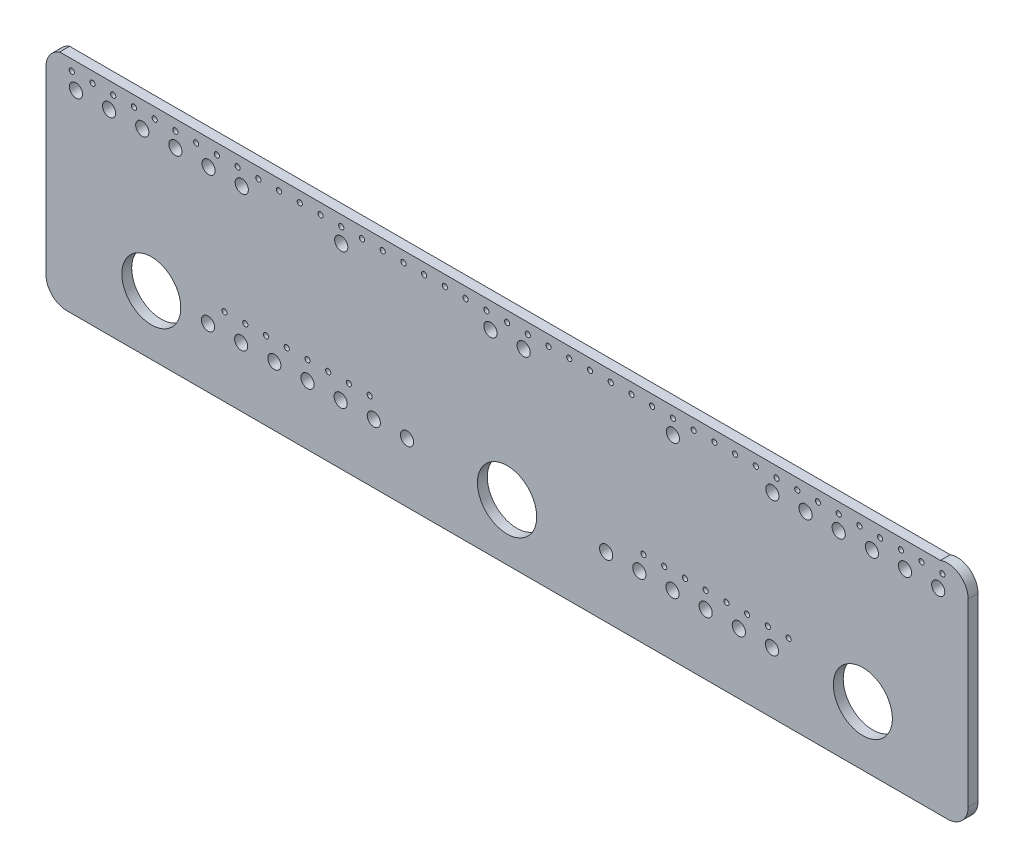
from build123d import *

# Parameters (mm, degrees)
SKETCH1_R           = 14.225
SKETCH1_R_2         = 14.3
SKETCH1_R_3         = 3.18
SKETCH1_R_4         = 1.25
BOSS_EXTRUDE5_DEPTH = 4.7625


with BuildPart() as part:
    # Sketch1 → Boss-Extrude5 (new body)
    with BuildSketch(Plane.XY):
        with BuildLine():
            Line((-438.54516333, 90.490429708), (-13.66516333, 90.490429708))
            ThreePointArc((-13.66516333, 90.490429708), (-4.523203097, 89.26845658), (-0.269770336, 81.084511017))
            Line((-0.269770336, 81.084511017), (-0.269770336, -5.909570292))
            ThreePointArc((-0.269770336, -5.909570292), (-3.198702525, -12.980638104), (-10.269770336, -15.909570292))
            Line((-10.269770336, -15.909570292), (-435.149770336, -15.909570292))
            ThreePointArc((-435.149770336, -15.909570292), (-442.220838148, -12.980638104), (-445.149770336, -5.909570292))
            Line((-445.149770336, -5.909570292), (-445.149770336, 81.084511017))
            ThreePointArc((-445.149770336, 81.084511017), (-443.333715899, 86.831078256), (-438.54516333, 90.490429708))
        make_face()
        with Locations(Location((-394.349770336, 12.790429708, 0), (0, 0, 180))):
            Circle(SKETCH1_R, mode=Mode.SUBTRACT)
        with Locations(Location((-51.069770336, 12.790429708, 0), (0, 0, 180))):
            Circle(SKETCH1_R, mode=Mode.SUBTRACT)
        with Locations(Location((-222.709770336, 11.290429708, 0), (0, 0, 180))):
            Circle(SKETCH1_R_2, mode=Mode.SUBTRACT)
        with Locations(Location((-174.899770336, 13.384511017, 0), (0, 0, 180))):
            Circle(SKETCH1_R_3, mode=Mode.SUBTRACT)
        with Locations(Location((-366.990768764, 12.790429708, 0), (0, 0, 180))):
            Circle(SKETCH1_R_3, mode=Mode.SUBTRACT)
        with Locations(Location((-358.995687615, 21.719099167, 0), (0, 0, 180))):
            Circle(SKETCH1_R_4, mode=Mode.SUBTRACT)
        with Locations(Location((-94.899770336, 13.384511017, 0), (0, 0, 180))):
            Circle(SKETCH1_R_3, mode=Mode.SUBTRACT)
        with Locations(Location((-96.899770336, 21.384511017, 0), (0, 0, 180))):
            Circle(SKETCH1_R_4, mode=Mode.SUBTRACT)
        with Locations(Location((-106.899770336, 21.384511017, 0), (0, 0, 180))):
            Circle(SKETCH1_R_4, mode=Mode.SUBTRACT)
        with Locations(Location((-350.990768764, 12.790429708, 0), (0, 0, 180))):
            Circle(SKETCH1_R_3, mode=Mode.SUBTRACT)
        with Locations(Location((-334.990768764, 12.790429708, 0), (0, 0, 180))):
            Circle(SKETCH1_R_3, mode=Mode.SUBTRACT)
        with Locations(Location((-318.990768764, 12.790429708, 0), (0, 0, 180))):
            Circle(SKETCH1_R_3, mode=Mode.SUBTRACT)
        with Locations(Location((-302.990768764, 12.790429708, 0), (0, 0, 180))):
            Circle(SKETCH1_R_3, mode=Mode.SUBTRACT)
        with Locations(Location((-286.990768764, 12.790429708, 0), (0, 0, 180))):
            Circle(SKETCH1_R_3, mode=Mode.SUBTRACT)
        with Locations(Location((-158.899770336, 13.384511017, 0), (0, 0, 180))):
            Circle(SKETCH1_R_3, mode=Mode.SUBTRACT)
        with Locations(Location((-142.899770336, 13.384511017, 0), (0, 0, 180))):
            Circle(SKETCH1_R_3, mode=Mode.SUBTRACT)
        with Locations(Location((-126.899770336, 13.384511017, 0), (0, 0, 180))):
            Circle(SKETCH1_R_3, mode=Mode.SUBTRACT)
        with Locations(Location((-110.899770336, 13.384511017, 0), (0, 0, 180))):
            Circle(SKETCH1_R_3, mode=Mode.SUBTRACT)
        with Locations(Location((-86.899770336, 21.384511017, 0), (0, 0, 180))):
            Circle(SKETCH1_R_4, mode=Mode.SUBTRACT)
        with Locations(Location((-270.990768764, 12.790429708, 0), (0, 0, 180))):
            Circle(SKETCH1_R_3, mode=Mode.SUBTRACT)
        with Locations(Location((-348.995687615, 21.719099167, 0), (0, 0, 180))):
            Circle(SKETCH1_R_4, mode=Mode.SUBTRACT)
        with Locations(Location((-116.899770336, 21.384511017, 0), (0, 0, 180))):
            Circle(SKETCH1_R_4, mode=Mode.SUBTRACT)
        with Locations(Location((-338.995687615, 21.719099167, 0), (0, 0, 180))):
            Circle(SKETCH1_R_4, mode=Mode.SUBTRACT)
        with Locations(Location((-328.995687615, 21.719099167, 0), (0, 0, 180))):
            Circle(SKETCH1_R_4, mode=Mode.SUBTRACT)
        with Locations(Location((-318.995687615, 21.719099167, 0), (0, 0, 180))):
            Circle(SKETCH1_R_4, mode=Mode.SUBTRACT)
        with Locations(Location((-308.995687615, 21.719099167, 0), (0, 0, 180))):
            Circle(SKETCH1_R_4, mode=Mode.SUBTRACT)
        with Locations(Location((-298.995687615, 21.719099167, 0), (0, 0, 180))):
            Circle(SKETCH1_R_4, mode=Mode.SUBTRACT)
        with Locations(Location((-288.995687615, 21.719099167, 0), (0, 0, 180))):
            Circle(SKETCH1_R_4, mode=Mode.SUBTRACT)
        with Locations(Location((-126.899770336, 21.384511017, 0), (0, 0, 180))):
            Circle(SKETCH1_R_4, mode=Mode.SUBTRACT)
        with Locations(Location((-136.899770336, 21.384511017, 0), (0, 0, 180))):
            Circle(SKETCH1_R_4, mode=Mode.SUBTRACT)
        with Locations(Location((-146.899770336, 21.384511017, 0), (0, 0, 180))):
            Circle(SKETCH1_R_4, mode=Mode.SUBTRACT)
        with Locations(Location((-156.899770336, 21.384511017, 0), (0, 0, 180))):
            Circle(SKETCH1_R_4, mode=Mode.SUBTRACT)
        with Locations(Location((-222.709770336, 85.384511017, 0), (0, 0, 180))):
            Circle(SKETCH1_R_4, mode=Mode.SUBTRACT)
        with Locations(Location((-142.709770336, 78.334511017, 0), (0, 0, 180))):
            Circle(SKETCH1_R_3, mode=Mode.SUBTRACT)
        with Locations(Location((-94.709770336, 78.334511017, 0), (0, 0, 180))):
            Circle(SKETCH1_R_3, mode=Mode.SUBTRACT)
        with Locations(Location((-78.709770336, 78.334511017, 0), (0, 0, 180))):
            Circle(SKETCH1_R_3, mode=Mode.SUBTRACT)
        with Locations(Location((-30.709770336, 78.334511017, 0), (0, 0, 180))):
            Circle(SKETCH1_R_3, mode=Mode.SUBTRACT)
        with Locations(Location((-14.709770336, 78.334511017, 0), (0, 0, 180))):
            Circle(SKETCH1_R_3, mode=Mode.SUBTRACT)
        with Locations(Location((-302.709770336, 78.334511017, 0), (0, 0, 180))):
            Circle(SKETCH1_R_3, mode=Mode.SUBTRACT)
        with Locations(Location((-350.709770336, 78.334511017, 0), (0, 0, 180))):
            Circle(SKETCH1_R_3, mode=Mode.SUBTRACT)
        with Locations(Location((-366.709770336, 78.334511017, 0), (0, 0, 180))):
            Circle(SKETCH1_R_3, mode=Mode.SUBTRACT)
        with Locations(Location((-414.709770336, 78.334511017, 0), (0, 0, 180))):
            Circle(SKETCH1_R_3, mode=Mode.SUBTRACT)
        with Locations(Location((-212.709770336, 85.384511017, 0), (0, 0, 180))):
            Circle(SKETCH1_R_4, mode=Mode.SUBTRACT)
        with Locations(Location((-202.709770336, 85.384511017, 0), (0, 0, 180))):
            Circle(SKETCH1_R_4, mode=Mode.SUBTRACT)
        with Locations(Location((-192.709770336, 85.384511017, 0), (0, 0, 180))):
            Circle(SKETCH1_R_4, mode=Mode.SUBTRACT)
        with Locations(Location((-182.709770336, 85.384511017, 0), (0, 0, 180))):
            Circle(SKETCH1_R_4, mode=Mode.SUBTRACT)
        with Locations(Location((-172.709770336, 85.384511017, 0), (0, 0, 180))):
            Circle(SKETCH1_R_4, mode=Mode.SUBTRACT)
        with Locations(Location((-162.709770336, 85.384511017, 0), (0, 0, 180))):
            Circle(SKETCH1_R_4, mode=Mode.SUBTRACT)
        with Locations(Location((-152.709770336, 85.384511017, 0), (0, 0, 180))):
            Circle(SKETCH1_R_4, mode=Mode.SUBTRACT)
        with Locations(Location((-142.709770336, 85.384511017, 0), (0, 0, 180))):
            Circle(SKETCH1_R_4, mode=Mode.SUBTRACT)
        with Locations(Location((-132.709770336, 85.384511017, 0), (0, 0, 180))):
            Circle(SKETCH1_R_4, mode=Mode.SUBTRACT)
        with Locations(Location((-122.709770336, 85.384511017, 0), (0, 0, 180))):
            Circle(SKETCH1_R_4, mode=Mode.SUBTRACT)
        with Locations(Location((-112.709770336, 85.384511017, 0), (0, 0, 180))):
            Circle(SKETCH1_R_4, mode=Mode.SUBTRACT)
        with Locations(Location((-102.709770336, 85.384511017, 0), (0, 0, 180))):
            Circle(SKETCH1_R_4, mode=Mode.SUBTRACT)
        with Locations(Location((-92.709770336, 85.384511017, 0), (0, 0, 180))):
            Circle(SKETCH1_R_4, mode=Mode.SUBTRACT)
        with Locations(Location((-82.709770336, 85.384511017, 0), (0, 0, 180))):
            Circle(SKETCH1_R_4, mode=Mode.SUBTRACT)
        with Locations(Location((-72.709770336, 85.384511017, 0), (0, 0, 180))):
            Circle(SKETCH1_R_4, mode=Mode.SUBTRACT)
        with Locations(Location((-62.709770336, 85.384511017, 0), (0, 0, 180))):
            Circle(SKETCH1_R_4, mode=Mode.SUBTRACT)
        with Locations(Location((-52.709770336, 85.384511017, 0), (0, 0, 180))):
            Circle(SKETCH1_R_4, mode=Mode.SUBTRACT)
        with Locations(Location((-42.709770336, 85.384511017, 0), (0, 0, 180))):
            Circle(SKETCH1_R_4, mode=Mode.SUBTRACT)
        with Locations(Location((-32.709770336, 85.384511017, 0), (0, 0, 180))):
            Circle(SKETCH1_R_4, mode=Mode.SUBTRACT)
        with Locations(Location((-22.709770336, 85.384511017, 0), (0, 0, 180))):
            Circle(SKETCH1_R_4, mode=Mode.SUBTRACT)
        with Locations(Location((-12.709770336, 85.384511017, 0), (0, 0, 180))):
            Circle(SKETCH1_R_4, mode=Mode.SUBTRACT)
        with Locations(Location((-232.709770336, 85.384511017, 0), (0, 0, 180))):
            Circle(SKETCH1_R_4, mode=Mode.SUBTRACT)
        with Locations(Location((-242.709770336, 85.384511017, 0), (0, 0, 180))):
            Circle(SKETCH1_R_4, mode=Mode.SUBTRACT)
        with Locations(Location((-252.709770336, 85.384511017, 0), (0, 0, 180))):
            Circle(SKETCH1_R_4, mode=Mode.SUBTRACT)
        with Locations(Location((-262.709770336, 85.384511017, 0), (0, 0, 180))):
            Circle(SKETCH1_R_4, mode=Mode.SUBTRACT)
        with Locations(Location((-272.709770336, 85.384511017, 0), (0, 0, 180))):
            Circle(SKETCH1_R_4, mode=Mode.SUBTRACT)
        with Locations(Location((-282.709770336, 85.384511017, 0), (0, 0, 180))):
            Circle(SKETCH1_R_4, mode=Mode.SUBTRACT)
        with Locations(Location((-292.709770336, 85.384511017, 0), (0, 0, 180))):
            Circle(SKETCH1_R_4, mode=Mode.SUBTRACT)
        with Locations(Location((-302.709770336, 85.384511017, 0), (0, 0, 180))):
            Circle(SKETCH1_R_4, mode=Mode.SUBTRACT)
        with Locations(Location((-312.709770336, 85.384511017, 0), (0, 0, 180))):
            Circle(SKETCH1_R_4, mode=Mode.SUBTRACT)
        with Locations(Location((-322.709770336, 85.384511017, 0), (0, 0, 180))):
            Circle(SKETCH1_R_4, mode=Mode.SUBTRACT)
        with Locations(Location((-332.709770336, 85.384511017, 0), (0, 0, 180))):
            Circle(SKETCH1_R_4, mode=Mode.SUBTRACT)
        with Locations(Location((-342.709770336, 85.384511017, 0), (0, 0, 180))):
            Circle(SKETCH1_R_4, mode=Mode.SUBTRACT)
        with Locations(Location((-352.709770336, 85.384511017, 0), (0, 0, 180))):
            Circle(SKETCH1_R_4, mode=Mode.SUBTRACT)
        with Locations(Location((-362.709770336, 85.384511017, 0), (0, 0, 180))):
            Circle(SKETCH1_R_4, mode=Mode.SUBTRACT)
        with Locations(Location((-372.709770336, 85.384511017, 0), (0, 0, 180))):
            Circle(SKETCH1_R_4, mode=Mode.SUBTRACT)
        with Locations(Location((-382.709770336, 85.384511017, 0), (0, 0, 180))):
            Circle(SKETCH1_R_4, mode=Mode.SUBTRACT)
        with Locations(Location((-392.709770336, 85.384511017, 0), (0, 0, 180))):
            Circle(SKETCH1_R_4, mode=Mode.SUBTRACT)
        with Locations(Location((-402.709770336, 85.384511017, 0), (0, 0, 180))):
            Circle(SKETCH1_R_4, mode=Mode.SUBTRACT)
        with Locations(Location((-412.709770336, 85.384511017, 0), (0, 0, 180))):
            Circle(SKETCH1_R_4, mode=Mode.SUBTRACT)
        with Locations(Location((-422.709770336, 85.384511017, 0), (0, 0, 180))):
            Circle(SKETCH1_R_4, mode=Mode.SUBTRACT)
        with Locations(Location((-432.709770336, 85.384511017, 0), (0, 0, 180))):
            Circle(SKETCH1_R_4, mode=Mode.SUBTRACT)
        with Locations(Location((-430.709770336, 78.334511017, 0), (0, 0, 180))):
            Circle(SKETCH1_R_3, mode=Mode.SUBTRACT)
        with Locations(Location((-230.709770336, 78.334511017, 0), (0, 0, 180))):
            Circle(SKETCH1_R_3, mode=Mode.SUBTRACT)
        with Locations(Location((-214.709770336, 78.334511017, 0), (0, 0, 180))):
            Circle(SKETCH1_R_3, mode=Mode.SUBTRACT)
        with Locations(Location((-398.709770336, 78.334511017, 0), (0, 0, 180))):
            Circle(SKETCH1_R_3, mode=Mode.SUBTRACT)
        with Locations(Location((-382.709770336, 78.334511017, 0), (0, 0, 180))):
            Circle(SKETCH1_R_3, mode=Mode.SUBTRACT)
        with Locations(Location((-46.709770336, 78.334511017, 0), (0, 0, 180))):
            Circle(SKETCH1_R_3, mode=Mode.SUBTRACT)
        with Locations(Location((-62.709770336, 78.334511017, 0), (0, 0, 180))):
            Circle(SKETCH1_R_3, mode=Mode.SUBTRACT)
    extrude(amount=BOSS_EXTRUDE5_DEPTH)


solid = part.part
